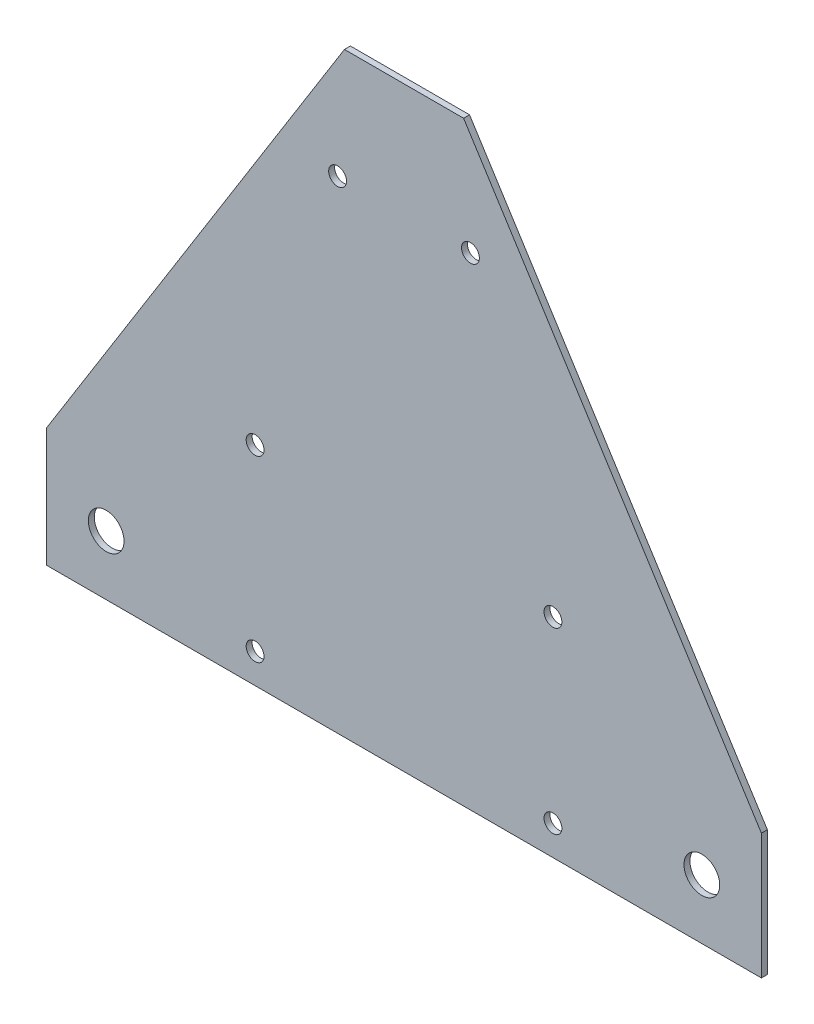
from build123d import *

# Parameters (mm, degrees)
SKETCH_1_R          = 3
EXTRUDE_2_DEPTH     = 1
SKETCH_3_R          = 1.5
CUT_EXTRUDE_1_DEPTH = 10
SKETCH_5_R          = 1.5
CUT_EXTRUDE_2_DEPTH = 1


with BuildPart() as part:
    # 草图1 → 凸台-拉伸2 (new body)
    with BuildSketch(Plane.XY):
        Polygon((-10, 50.109212084), (10, 50.109212084), (60, -28.838156337), (60, -49.890787916), (-60, -49.890787916), (-60, -29.890787916), align=None)
        with Locations((-50, -39.890787916)):
            Circle(SKETCH_1_R, mode=Mode.SUBTRACT)
        with Locations((50, -39.890787916)):
            Circle(SKETCH_1_R, mode=Mode.SUBTRACT)
    extrude(amount=EXTRUDE_2_DEPTH)

    # 草图3 → 切除-拉伸1 (cut)
    with BuildSketch(Plane.XY.offset(1)):
        with Locations((-11.15, 31.109212084)):
            Circle(SKETCH_3_R)
        with Locations((11.15, 31.109212084)):
            Circle(SKETCH_3_R)
    extrude(amount=-CUT_EXTRUDE_1_DEPTH, mode=Mode.SUBTRACT)

    # 草图5 → 切除-拉伸2 (cut)
    with BuildSketch(Plane.XY.offset(1)):
        with Locations((25, -14.890787916)):
            Circle(SKETCH_5_R)
        with Locations((25, -44.890787916)):
            Circle(SKETCH_5_R)
        with Locations(Location((-25, -44.890787916, 0), (0, 0, 180))):
            Circle(SKETCH_5_R)
        with Locations(Location((-25, -14.890787916, 0), (0, 0, 180))):
            Circle(SKETCH_5_R)
    extrude(amount=-CUT_EXTRUDE_2_DEPTH, mode=Mode.SUBTRACT)


solid = part.part
